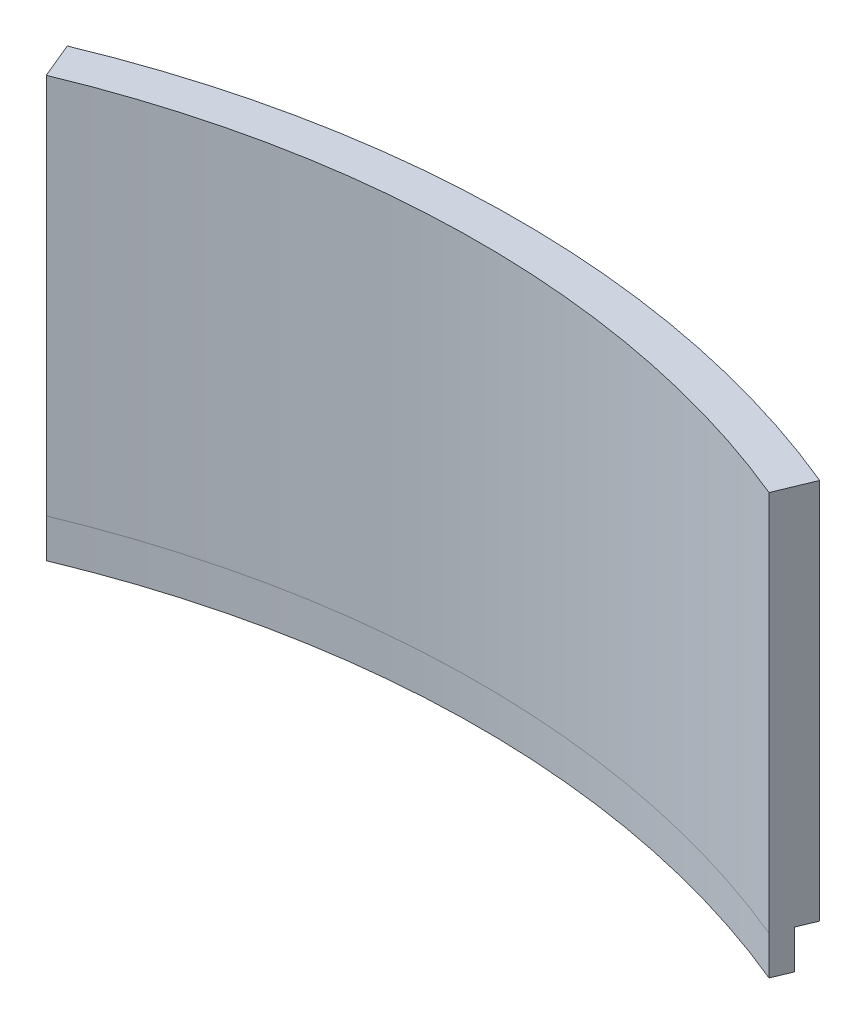
from build123d import *

# Parameters (mm, degrees)
BOSS_EXTRUDE1_DEPTH = 26.5
BOSS_EXTRUDE2_START = 3
BOSS_EXTRUDE2_DEPTH = 3
BOSS_EXTRUDE3_DEPTH = 3


with BuildPart() as part:
    # Sketch1 → Boss-Extrude1 (new body)
    with BuildSketch(Plane(origin=(0, 0, 0), x_dir=(1, 0, 0), z_dir=(0, 1, 0))):
        with BuildLine():
            Line((29.08394086, 70.214844471), (27.935890563, 67.443205873))
            ThreePointArc((27.935890563, 67.443205873), (0, 73), (-27.935890563, 67.443205873))
            Line((-27.935890563, 67.443205873), (-29.08394086, 70.214844471))
            ThreePointArc((-29.08394086, 70.214844471), (0, 76), (29.08394086, 70.214844471))
        make_face()
    extrude(amount=BOSS_EXTRUDE1_DEPTH)

    # Sketch2 → Boss-Extrude2 (add)
    with BuildSketch(Plane.XZ.offset(BOSS_EXTRUDE2_START)):
        with BuildLine():
            Line((27.935890563, -67.443205873), (29.08394086, -70.214844471))
            ThreePointArc((29.08394086, -70.214844471), (0, -76), (-29.08394086, -70.214844471))
            Line((-29.08394086, -70.214844471), (-27.935890563, -67.443205873))
            ThreePointArc((-27.935890563, -67.443205873), (0, -73), (27.935890563, -67.443205873))
        make_face()
    extrude(amount=-BOSS_EXTRUDE2_DEPTH)

    # Sketch3 → Boss-Extrude3 (add)
    with BuildSketch(Plane.XZ.offset(3)):
        with BuildLine():
            Line((27.935890563, -67.443205873), (28.509915711, -68.829025172))
            ThreePointArc((28.509915711, -68.829025172), (0, -74.519275475), (-28.509915711, -68.829025172))
            Line((-28.509915711, -68.829025172), (-27.935890563, -67.443205873))
            ThreePointArc((-27.935890563, -67.443205873), (0, -73.019276769), (27.935890563, -67.443205873))
        make_face()
    extrude(amount=BOSS_EXTRUDE3_DEPTH)


solid = part.part
